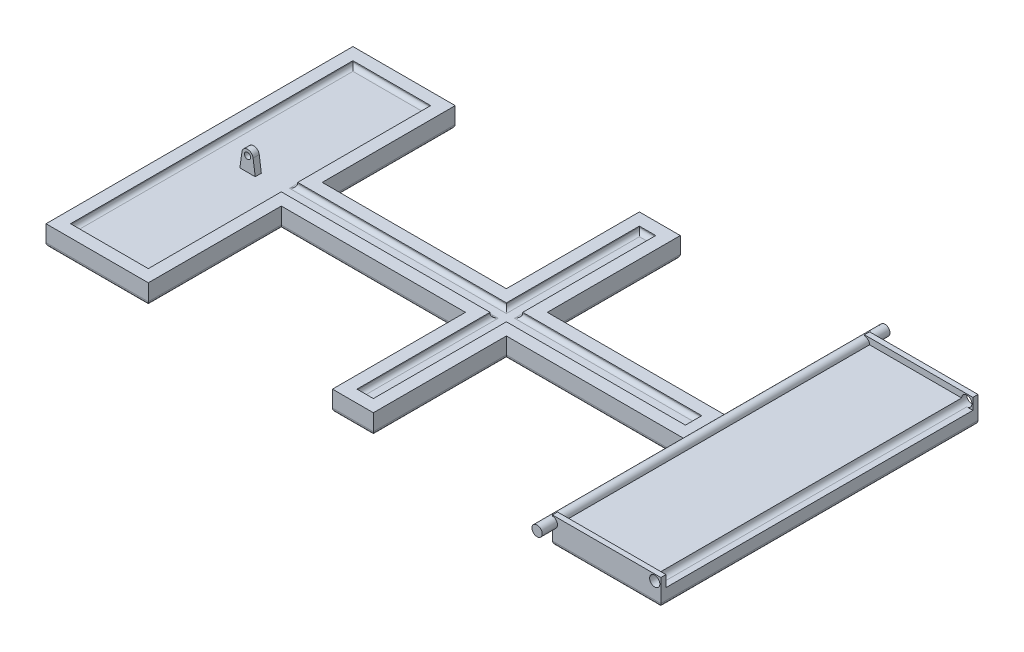
from build123d import *

# Parameters (mm, degrees)
BOSS_EXTRUDE1_DEPTH      = 10
BOSS_EXTRUDE2_DEPTH      = 10
BOSS_EXTRUDE2_DEPTH_BACK = 160
SKETCH4_R                = 2.5
CUT_EXTRUDE2_DEPTH       = 2.5
FILLET1_R                = 2
BOSS_EXTRUDE6_DEPTH      = 2.5
BOSS_EXTRUDE7_DEPTH      = 3
SKETCH8_W                = 2.5
SKETCH8_H                = 3
BOSS_EXTRUDE8_DEPTH      = 47
SKETCH9_R                = 2.5
CUT_EXTRUDE3_DEPTH       = 344.969838794
SKETCH10_W               = 3
SKETCH10_H               = 150
BOSS_EXTRUDE9_DEPTH      = 0.5
FILLET2_R                = 2
SKETCH11_W               = 7.5
SKETCH11_H               = 3
BOSS_EXTRUDE10_DEPTH     = 10
SKETCH12_R               = 1.5
CUT_EXTRUDE4_DEPTH       = 10


with BuildPart() as part:
    # Sketch3 → Boss-Extrude1 (new body)
    with BuildSketch(Plane(origin=(0, 0, 0), x_dir=(1, 0, 0), z_dir=(0, 1, 0))):
        Polygon((50, 85), (50, 150), (0, 150), (0, 0), (50, 0), (50, 65), (140, 65), (140, 0), (160, 0), (160, 65), (250, 65), (250, 0), (300, 0), (300, 150), (250, 150), (250, 85), (160, 85), (160, 150), (140, 150), (140, 85), align=None)
    extrude(amount=-BOSS_EXTRUDE1_DEPTH)

    # Sketch4 → Boss-Extrude2 (add, two sides: drawn at the far end of the back side and taken through both)
    with BuildSketch(Plane.XY.offset(-BOSS_EXTRUDE2_DEPTH_BACK)):
        with Locations((250, 0)):
            Circle(SKETCH4_R)
    extrude(amount=BOSS_EXTRUDE2_DEPTH + BOSS_EXTRUDE2_DEPTH_BACK)

    # Sketch5 → Cut-Extrude2 (cut)
    with BuildSketch(Plane(origin=(0, 0, 0), x_dir=(1, 0, 0), z_dir=(0, 1, 0))):
        Polygon((44, 144), (6, 144), (6, 6), (44, 6), (44, 71), (146, 71), (146, 6), (154, 6), (154, 71), (241.5, 71), (241.5, 79), (154, 79), (154, 144), (146, 144), (146, 79), (44, 79), align=None)
    extrude(amount=-CUT_EXTRUDE2_DEPTH, mode=Mode.SUBTRACT)

    # Fillet1
    fillet1_edges = [part.edges().sort_by_distance(p)[0] for p in [
        (95, -2.5, -71),
        (44, -2.5, -38.5),
        (25, -2.5, -6),
        (6, -2.5, -75),
        (25, -2.5, -144),
        (44, -2.5, -111.5),
        (95, -2.5, -79),
        (146, -2.5, -111.5),
        (150, -2.5, -144),
        (154, -2.5, -111.5),
        (197.75, -2.5, -79),
        (241.5, -2.5, -75),
        (197.75, -2.5, -71),
        (154, -2.5, -38.5),
        (150, -2.5, -6),
        (146, -2.5, -38.5),
    ]]
    fillet(fillet1_edges, radius=FILLET1_R)

    # Sketch6 → Boss-Extrude6 (add)
    with BuildSketch(Plane.XY):
        with BuildLine():
            Line((297, 3), (297, 0))
            Line((297, 0), (297.5, 0))
            ThreePointArc((297.5, 0), (300, 2.5), (302.5, 0))
            ThreePointArc((302.5, 0), (301.767766953, -1.767766953), (300, -2.5))
            Line((300, -2.5), (300, -3))
            Line((300, -3), (303, -3))
            Line((303, -3), (303, 3))
            Line((303, 3), (297, 3))
        make_face()
        with BuildLine():
            Line((297.5, 0), (297, 0))
            Line((297, 0), (252.5, 0))
            ThreePointArc((252.5, 0), (251.767766953, -1.767766953), (250, -2.5))
            Line((250, -2.5), (250, -10))
            Line((250, -10), (300, -10))
            Line((300, -10), (300, -3))
            Line((300, -3), (300, -2.5))
            ThreePointArc((300, -2.5), (298.232233047, -1.767766953), (297.5, 0))
        make_face()
    boss_extrude6 = extrude(amount=BOSS_EXTRUDE6_DEPTH)

    # Mirror2: Boss-Extrude6 across plane
    add(boss_extrude6.mirror(Plane.XY.offset(-75)))

    # Sketch7 → Boss-Extrude7 (add)
    with BuildSketch(Plane(origin=(300, 0, 0), x_dir=(0, 0, -1), z_dir=(1, 0, 0))):
        Polygon((0, -3), (150, -3), (152.5, -3), (152.5, -10), (-2.5, -10), (-2.5, -3), align=None)
    extrude(amount=BOSS_EXTRUDE7_DEPTH)

    # Sketch8 → Boss-Extrude8 (add)
    with BuildSketch(Plane.ZY.offset(-297)):
        with Locations((1.25, 1.5)):
            Rectangle(SKETCH8_W, SKETCH8_H)
    boss_extrude8 = extrude(amount=BOSS_EXTRUDE8_DEPTH)

    # Mirror3: Boss-Extrude8 across plane
    add(boss_extrude8.mirror(Plane.XY.offset(-75)))

    # Sketch9 → Cut-Extrude3 (cut, through all)
    with BuildSketch(Plane.XY.offset(2.5)):
        with Locations((300, 0)):
            Circle(SKETCH9_R)
    extrude(amount=-CUT_EXTRUDE3_DEPTH, mode=Mode.SUBTRACT)

    # Sketch10 → Boss-Extrude9 (add)
    with BuildSketch(Plane(origin=(0, -3, 0), x_dir=(1, 0, 0), z_dir=(0, 1, 0))):
        with Locations((301.5, 75)):
            Rectangle(SKETCH10_W, SKETCH10_H)
    extrude(amount=BOSS_EXTRUDE9_DEPTH)

    # Fillet2
    fillet2_edges = [part.edges().sort_by_distance(p)[0] for p in [
        (50, -10, -32.5),
        (95, -10, -65),
        (275, -10, 2.5),
        (140, -10, -32.5),
        (275, -10, -152.5),
        (150, -10, 0),
        (303, -10, -75),
        (160, -10, -32.5),
        (205, -10, -65),
        (250, -10, -32.5),
        (250, -10, -117.5),
        (25, -10, 0),
        (205, -10, -85),
        (160, -10, -117.5),
        (150, -10, -150),
        (140, -10, -117.5),
        (95, -10, -85),
        (50, -10, -117.5),
        (25, -10, -150),
        (0, -10, -75),
    ]]
    fillet(fillet2_edges, radius=FILLET2_R)

    # Sketch11 → Boss-Extrude10 (add)
    with BuildSketch(Plane(origin=(0, -2.5, 0), x_dir=(1, 0, 0), z_dir=(0, 1, 0))):
        with Locations((25, 75)):
            Rectangle(SKETCH11_W, SKETCH11_H)
    extrude(amount=BOSS_EXTRUDE10_DEPTH)

    # Sketch12 → Cut-Extrude4 (cut)
    with BuildSketch(Plane.XY.offset(-73.5)):
        with Locations((25, 4.5)):
            Circle(SKETCH12_R)
        with BuildLine():
            Line((28.75, -2.5), (27.723784263, 4.878812998))
            ThreePointArc((27.723784263, 4.878812998), (25, 7.25), (22.276215737, 4.878812998))
            Line((22.276215737, 4.878812998), (21.25, -2.5))
            Line((21.25, -2.5), (21.25, 7.5))
            Line((21.25, 7.5), (28.75, 7.5))
            Line((28.75, 7.5), (28.75, -2.5))
        make_face()
    extrude(amount=-CUT_EXTRUDE4_DEPTH, mode=Mode.SUBTRACT)


solid = part.part
